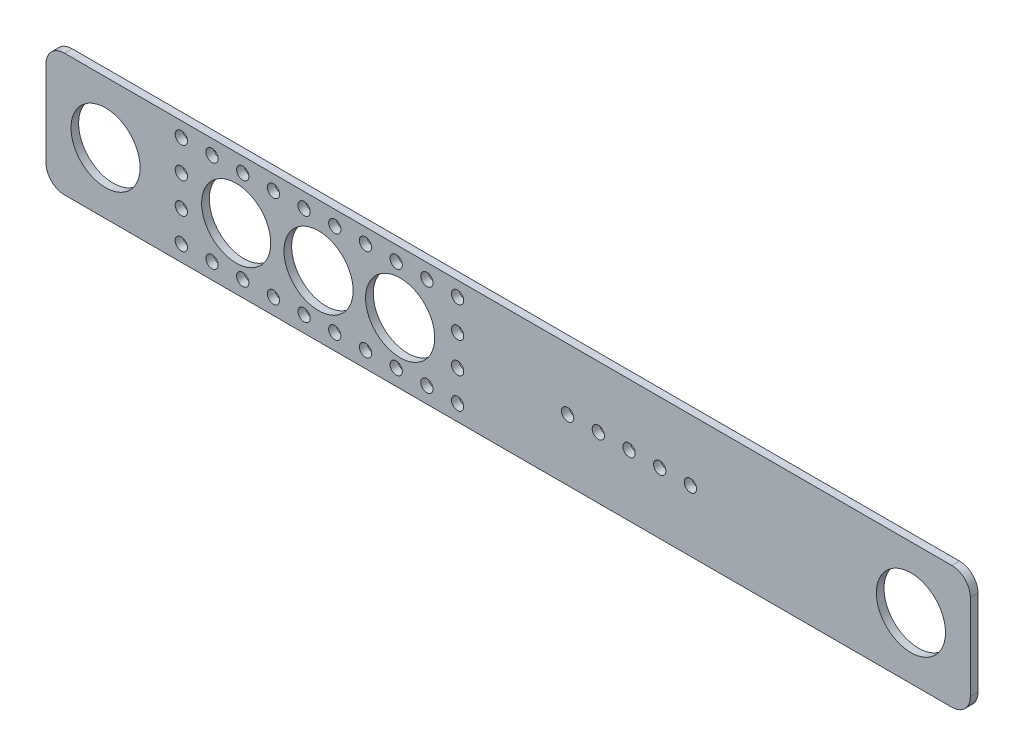
from build123d import *

# Parameters (mm, degrees)
SKETCH1_W           = 382.452818204
SKETCH1_H           = 50.8
SKETCH1_R           = 14.3002
SKETCH1_R_2         = 2.54
BOSS_EXTRUDE1_DEPTH = 3.175
FILLET1_R           = 7.62


with BuildPart() as part:
    # Sketch1 → Boss-Extrude1 (new body)
    with BuildSketch(Plane.XY):
        with Locations((132.2654537, 9.352736133)):
            Rectangle(SKETCH1_W, SKETCH1_H)
        with Locations((-34.334788468, 9.352736133)):
            Circle(SKETCH1_R, mode=Mode.SUBTRACT)
        with Locations((298.913211532, 9.352736133)):
            Circle(SKETCH1_R, mode=Mode.SUBTRACT)
        with Locations((53.803211532, 9.352736133)):
            Circle(SKETCH1_R, mode=Mode.SUBTRACT)
        with Locations((87.573397818, 9.352736133)):
            Circle(SKETCH1_R, mode=Mode.SUBTRACT)
        with Locations((19.729570927, 9.352736133)):
            Circle(SKETCH1_R, mode=Mode.SUBTRACT)
        with Locations((156.877176863, 9.352736133)):
            Circle(SKETCH1_R_2, mode=Mode.SUBTRACT)
        with Locations((169.577176863, 9.352736133)):
            Circle(SKETCH1_R_2, mode=Mode.SUBTRACT)
        with Locations((182.277176863, 9.352736133)):
            Circle(SKETCH1_R_2, mode=Mode.SUBTRACT)
        with Locations((194.977176863, 9.352736133)):
            Circle(SKETCH1_R_2, mode=Mode.SUBTRACT)
        with Locations((207.677176863, 9.352736133)):
            Circle(SKETCH1_R_2, mode=Mode.SUBTRACT)
        with Locations((-2.968643943, 28.669348732)):
            Circle(SKETCH1_R_2, mode=Mode.SUBTRACT)
        with Locations((9.731356057, 28.669348732)):
            Circle(SKETCH1_R_2, mode=Mode.SUBTRACT)
        with Locations((22.431356057, 28.669348732)):
            Circle(SKETCH1_R_2, mode=Mode.SUBTRACT)
        with Locations((35.131356057, 28.669348732)):
            Circle(SKETCH1_R_2, mode=Mode.SUBTRACT)
        with Locations((47.831356057, 28.669348732)):
            Circle(SKETCH1_R_2, mode=Mode.SUBTRACT)
        with Locations((60.531356057, 28.669348732)):
            Circle(SKETCH1_R_2, mode=Mode.SUBTRACT)
        with Locations((73.231356057, 28.669348732)):
            Circle(SKETCH1_R_2, mode=Mode.SUBTRACT)
        with Locations((85.931356057, 28.669348732)):
            Circle(SKETCH1_R_2, mode=Mode.SUBTRACT)
        with Locations((98.631356057, 28.669348732)):
            Circle(SKETCH1_R_2, mode=Mode.SUBTRACT)
        with Locations((111.331356057, 28.669348732)):
            Circle(SKETCH1_R_2, mode=Mode.SUBTRACT)
        with Locations((111.331356057, 15.969348732)):
            Circle(SKETCH1_R_2, mode=Mode.SUBTRACT)
        with Locations((111.331356057, 3.269348732)):
            Circle(SKETCH1_R_2, mode=Mode.SUBTRACT)
        with Locations((9.731356057, -9.430651268)):
            Circle(SKETCH1_R_2, mode=Mode.SUBTRACT)
        with Locations((22.431356057, -9.430651268)):
            Circle(SKETCH1_R_2, mode=Mode.SUBTRACT)
        with Locations((35.131356057, -9.430651268)):
            Circle(SKETCH1_R_2, mode=Mode.SUBTRACT)
        with Locations((47.831356057, -9.430651268)):
            Circle(SKETCH1_R_2, mode=Mode.SUBTRACT)
        with Locations((60.531356057, -9.430651268)):
            Circle(SKETCH1_R_2, mode=Mode.SUBTRACT)
        with Locations((73.231356057, -9.430651268)):
            Circle(SKETCH1_R_2, mode=Mode.SUBTRACT)
        with Locations((85.931356057, -9.430651268)):
            Circle(SKETCH1_R_2, mode=Mode.SUBTRACT)
        with Locations((98.631356057, -9.430651268)):
            Circle(SKETCH1_R_2, mode=Mode.SUBTRACT)
        with Locations((111.331356057, -9.430651268)):
            Circle(SKETCH1_R_2, mode=Mode.SUBTRACT)
        with Locations((-2.968643943, 15.969348732)):
            Circle(SKETCH1_R_2, mode=Mode.SUBTRACT)
        with Locations((-2.968643943, 3.269348732)):
            Circle(SKETCH1_R_2, mode=Mode.SUBTRACT)
        with Locations((-2.968643943, -9.430651268)):
            Circle(SKETCH1_R_2, mode=Mode.SUBTRACT)
    extrude(amount=BOSS_EXTRUDE1_DEPTH)

    # Fillet1
    fillet1_edges = [part.edges().sort_by_distance(p)[0] for p in [
        (-58.960955402, 34.752736133, 1.5875),
        (323.491862802, 34.752736133, 1.5875),
        (323.491862802, -16.047263867, 1.5875),
        (-58.960955402, -16.047263867, 1.5875),
    ]]
    fillet(fillet1_edges, radius=FILLET1_R)


solid = part.part
